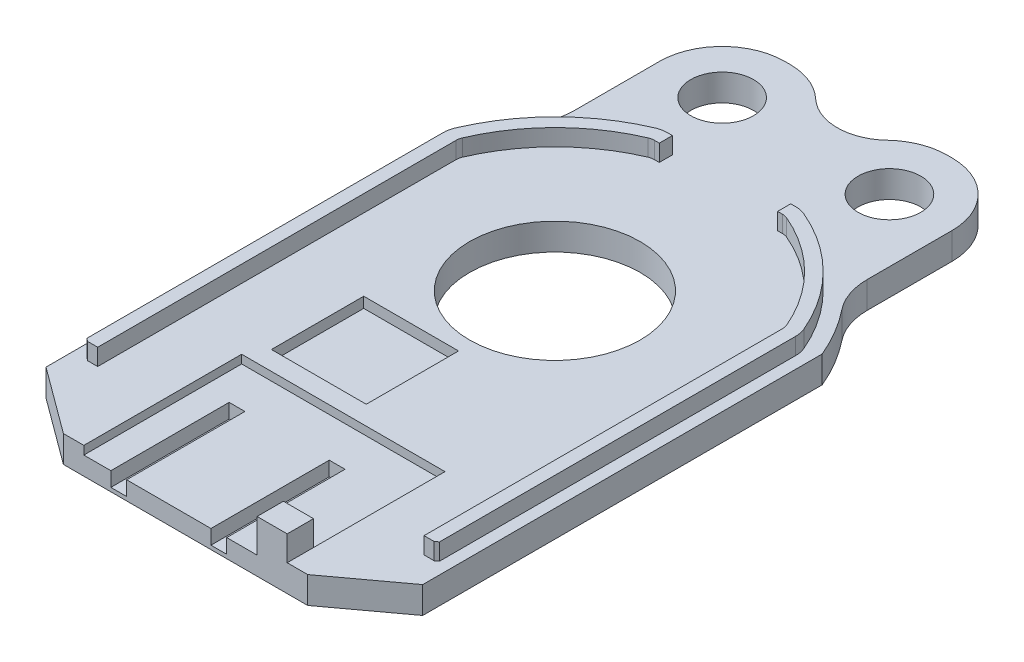
from build123d import *

# Parameters (mm, degrees)
SKETCH1_R           = 6.477
BOSS_EXTRUDE1_DEPTH = 2.032
CUT_EXTRUDE1_DEPTH  = 0.64008
SKETCH3_W           = 1.19888
SKETCH3_H           = 8.98144
CUT_EXTRUDE2_DEPTH  = 1.09982
SKETCH4_W           = 7.19836
SKETCH4_H           = 7.00786
CUT_EXTRUDE3_DEPTH  = 0.8001
BOSS_EXTRUDE2_DEPTH = 1.27
SKETCH6_W           = 2.286
SKETCH6_H           = 1.99898
BOSS_EXTRUDE3_DEPTH = 2.54
SKETCH7_R           = 2.38125
BOSS_EXTRUDE4_DEPTH = 2.032


with BuildPart() as part:
    # Sketch1 → Boss-Extrude1 (new body)
    with BuildSketch(Plane(origin=(0, 0, 0), x_dir=(1, 0, 0), z_dir=(0, 1, 0))):
        with BuildLine():
            Line((-14.3002, 5.9944), (-14.3002, -24.3332))
            Line((-14.3002, -24.3332), (-9.271, -28.0416))
            Line((-9.271, -28.0416), (9.271, -28.0416))
            Line((9.271, -28.0416), (14.3002, -24.3332))
            Line((14.3002, -24.3332), (14.3002, 5.9944))
            ThreePointArc((14.3002, 5.9944), (0, 15.505758653), (-14.3002, 5.9944))
        make_face()
        with Locations(Location((0, 0, 0), (0, 0, 270))):
            Circle(SKETCH1_R, mode=Mode.SUBTRACT)
    extrude(amount=BOSS_EXTRUDE1_DEPTH)

    # Sketch2 → Cut-Extrude1 (cut)
    with BuildSketch(Plane(origin=(0, 2.032, 0), x_dir=(1, 0, 0), z_dir=(0, 1, 0))):
        Polygon((0, -28.0416), (-7.71906, -28.0416), (-7.71906, -16.06042), (7.71906, -16.06042), (7.71906, -28.0416), align=None)
    extrude(amount=-CUT_EXTRUDE1_DEPTH, mode=Mode.SUBTRACT)

    # Sketch3 → Cut-Extrude2 (cut)
    with BuildSketch(Plane(origin=(0, 1.39192, 0), x_dir=(1, 0, 0), z_dir=(0, 1, 0))):
        with Locations((-5.06984, -23.55088)):
            Rectangle(SKETCH3_W, SKETCH3_H)
        with Locations((2.52984, -23.55088)):
            Rectangle(SKETCH3_W, SKETCH3_H)
    extrude(amount=-CUT_EXTRUDE2_DEPTH, mode=Mode.SUBTRACT)

    # Sketch4 → Cut-Extrude3 (cut)
    with BuildSketch(Plane(origin=(0, 2.032, 0), x_dir=(1, 0, 0), z_dir=(0, 1, 0))):
        with Locations((-3.299968, -11.116564)):
            Rectangle(SKETCH4_W, SKETCH4_H)
    extrude(amount=-CUT_EXTRUDE3_DEPTH, mode=Mode.SUBTRACT)

    # Sketch5 → Boss-Extrude2 (add)
    with BuildSketch(Plane(origin=(0, 2.032, 0), x_dir=(1, 0, 0), z_dir=(0, 1, 0))):
        with BuildLine():
            Line((12.40282, -22.33422), (13.171678, -22.33422))
            Line((13.171678, -22.33422), (13.40104, -22.152864))
            Line((13.40104, -22.152864), (13.40104, 4.882896))
            ThreePointArc((13.40104, 4.882896), (13.360125716, 5.283490726), (13.23975, 5.667756))
            ThreePointArc((13.23975, 5.667756), (10.160746855, 10.20631074), (5.608066, 13.264388))
            ThreePointArc((5.608066, 13.264388), (5.250053957, 13.366581837), (4.87934, 13.40104))
            Line((4.87934, 13.40104), (4.50342, 13.40104))
            Line((4.50342, 13.40104), (4.50342, 12.40282))
            Line((4.50342, 12.40282), (4.87934, 12.40282))
            ThreePointArc((4.87934, 12.40282), (5.080028543, 12.382451063), (5.272532, 12.322175))
            ThreePointArc((5.272532, 12.322175), (9.477779109, 9.479294357), (12.322175, 5.275072))
            ThreePointArc((12.322175, 5.275072), (12.382451063, 5.082568543), (12.40282, 4.88188))
            Line((12.40282, 4.88188), (12.40282, -22.33422))
        make_face()
        with BuildLine():
            Line((-4.850750436, 13.40104), (-4.474830436, 13.40104))
            Line((-4.474830436, 13.40104), (-4.474830436, 12.40282))
            Line((-4.474830436, 12.40282), (-4.850750436, 12.40282))
            ThreePointArc((-4.850750436, 12.40282), (-5.051438979, 12.382451063), (-5.243942436, 12.322175))
            ThreePointArc((-5.243942436, 12.322175), (-9.449189546, 9.479294357), (-12.293585436, 5.275072))
            ThreePointArc((-12.293585436, 5.275072), (-12.353861499, 5.082568543), (-12.374230436, 4.88188))
            Line((-12.374230436, 4.88188), (-12.374230436, -22.33422))
            Line((-12.374230436, -22.33422), (-13.143088436, -22.33422))
            Line((-13.143088436, -22.33422), (-13.372450436, -22.152864))
            Line((-13.372450436, -22.152864), (-13.372450436, 4.882896))
            ThreePointArc((-13.372450436, 4.882896), (-13.331536152, 5.283490726), (-13.211160436, 5.667756))
            ThreePointArc((-13.211160436, 5.667756), (-10.132157291, 10.20631074), (-5.579476436, 13.264388))
            ThreePointArc((-5.579476436, 13.264388), (-5.221464393, 13.366581837), (-4.850750436, 13.40104))
        make_face()
    extrude(amount=BOSS_EXTRUDE2_DEPTH)

    # Sketch6 → Boss-Extrude3 (add)
    with BuildSketch(Plane(origin=(0, 1.39192, 0), x_dir=(1, 0, 0), z_dir=(0, 1, 0))):
        with Locations((6.57606, -27.04211)):
            Rectangle(SKETCH6_W, SKETCH6_H)
    extrude(amount=BOSS_EXTRUDE3_DEPTH)

    # Sketch7 → Boss-Extrude4 (add)
    with BuildSketch(Plane.XZ):
        with BuildLine():
            ThreePointArc((-12.144798566, -9.640146223), (-11.377973728, -11.033206497), (-11.1125, -12.601058837))
            Line((-11.1125, -12.601058837), (-11.1125, -19.05))
            ThreePointArc((-11.1125, -19.05), (-9.717596045, -22.417596045), (-6.35, -23.8125))
            Line((-6.35, -23.8125), (-5.983425441, -23.8125))
            ThreePointArc((-5.983425441, -23.8125), (-4.22646321, -23.476566386), (-2.717363519, -22.516157205))
            ThreePointArc((-2.717363519, -22.516157205), (0, -21.4376), (2.717363519, -22.516157205))
            ThreePointArc((2.717363519, -22.516157205), (4.22646321, -23.476566386), (5.983425441, -23.8125))
            Line((5.983425441, -23.8125), (6.35, -23.8125))
            ThreePointArc((6.35, -23.8125), (9.717596045, -22.417596045), (11.1125, -19.05))
            Line((11.1125, -19.05), (11.1125, -12.601058837))
            ThreePointArc((11.1125, -12.601058837), (11.377973728, -11.033206497), (12.144798566, -9.640146223))
            ThreePointArc((12.144798566, -9.640146223), (0, -15.505758653), (-12.144798566, -9.640146223))
        make_face()
        with Locations(Location((-6.35, -19.05, 0), (0, 0, 270))):
            Circle(SKETCH7_R, mode=Mode.SUBTRACT)
        with Locations(Location((6.35, -19.05, 0), (0, 0, 270))):
            Circle(SKETCH7_R, mode=Mode.SUBTRACT)
    extrude(amount=-BOSS_EXTRUDE4_DEPTH)


solid = part.part
